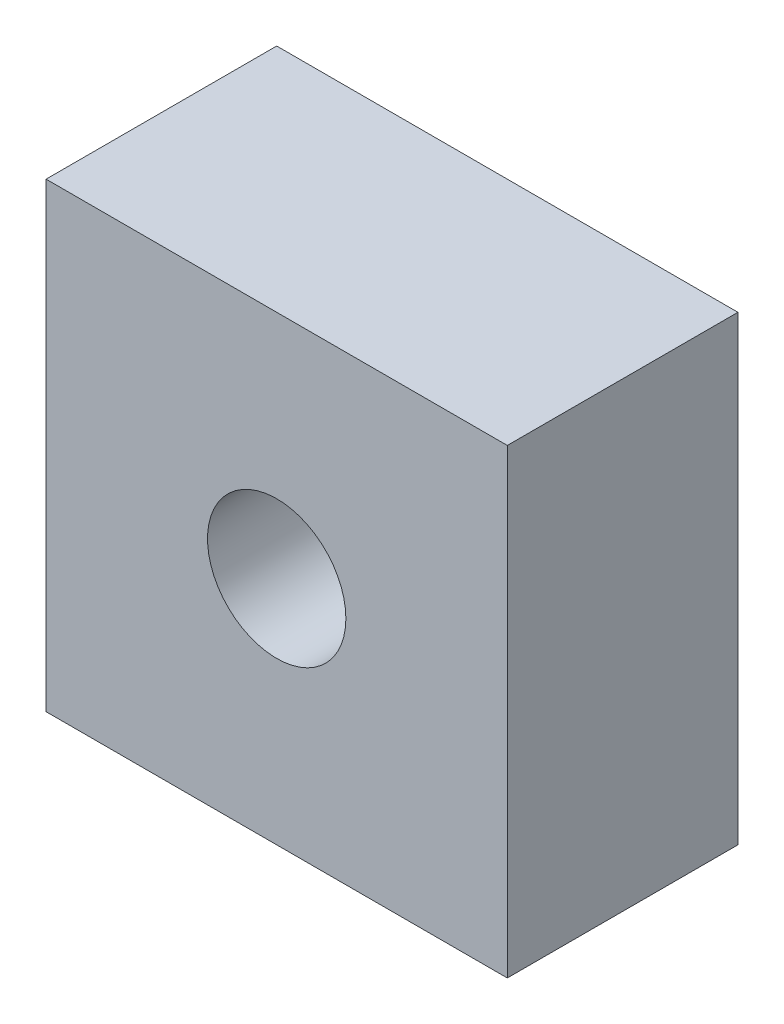
from build123d import *

# Parameters (mm, degrees)
SKETCH_1_W      = 10
SKETCH_1_H      = 10
SKETCH_1_R      = 1.5
EXTRUDE_1_DEPTH = 5


with BuildPart() as part:
    # ｽｹｯﾁ1 → ﾎﾞｽ - 押し出し1 (new body)
    with BuildSketch(Plane.XY):
        Rectangle(SKETCH_1_W, SKETCH_1_H)
        Circle(SKETCH_1_R, mode=Mode.SUBTRACT)
    extrude(amount=EXTRUDE_1_DEPTH)


solid = part.part
